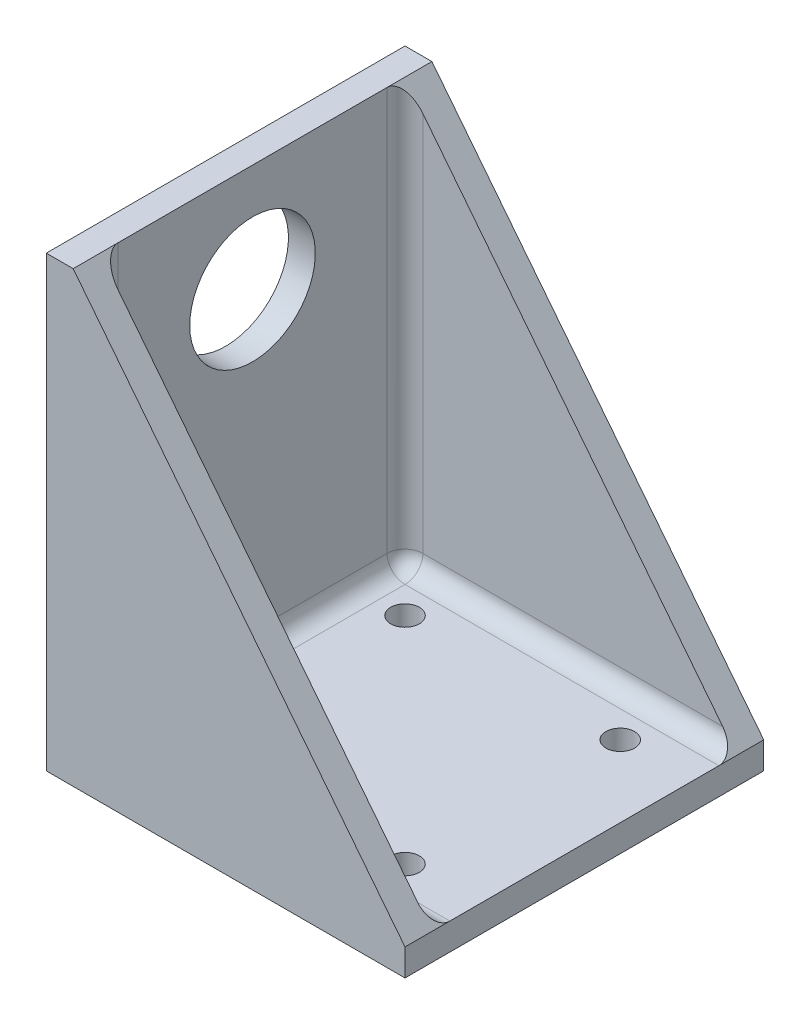
from build123d import *

# Parameters (mm, degrees)
SKETCH3_W           = 40
SKETCH3_H           = 40
SKETCH3_R           = 1.6
BOSS_EXTRUDE2_DEPTH = 3
SKETCH4_W           = 40
SKETCH4_H           = 50
SKETCH4_R           = 7
BOSS_EXTRUDE3_DEPTH = 3
BOSS_EXTRUDE4_DEPTH = 3
FILLET1_R           = 2


with BuildPart() as part:
    # Sketch3 → Boss-Extrude2 (new body)
    with BuildSketch(Plane(origin=(0, 0, 0), x_dir=(1, 0, 0), z_dir=(0, 1, 0))):
        Rectangle(SKETCH3_W, SKETCH3_H)
        with Locations(Location((-12, 12, 0), (0, 0, 270))):
            Circle(SKETCH3_R, mode=Mode.SUBTRACT)
        with Locations(Location((-12, -12, 0), (0, 0, 90))):
            Circle(SKETCH3_R, mode=Mode.SUBTRACT)
        with Locations(Location((12, -12, 0), (0, 0, 270))):
            Circle(SKETCH3_R, mode=Mode.SUBTRACT)
        with Locations(Location((12, 12, 0), (0, 0, 90))):
            Circle(SKETCH3_R, mode=Mode.SUBTRACT)
    extrude(amount=BOSS_EXTRUDE2_DEPTH)

    # Sketch4 → Boss-Extrude3 (add)
    with BuildSketch(Plane.ZY.offset(20)):
        with Locations((0, 25)):
            Rectangle(SKETCH4_W, SKETCH4_H)
        with Locations((0, 38)):
            Circle(SKETCH4_R, mode=Mode.SUBTRACT)
    extrude(amount=-BOSS_EXTRUDE3_DEPTH)

    # Sketch5 → Boss-Extrude4 (add)
    with BuildSketch(Plane.XY.offset(20)):
        Polygon((-20, 50), (-17, 50), (20, 3), (20, 0), (-20, 0), align=None)
    boss_extrude4 = extrude(amount=-BOSS_EXTRUDE4_DEPTH)

    # Mirror1: Boss-Extrude4 across plane
    add(boss_extrude4.mirror(Plane.XY))

    # Fillet1
    fillet1_edges = [part.edges().sort_by_distance(p)[0] for p in [
        (-17, 26.5, 17),
        (1.5, 3, 17),
        (-17, 3, 0),
        (-17, 26.5, -17),
        (1.5, 3, -17),
    ]]
    fillet(fillet1_edges, radius=FILLET1_R)


solid = part.part
